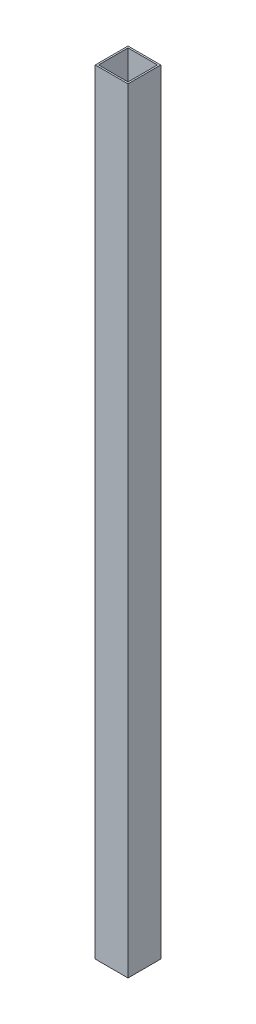
from build123d import *

# Parameters (mm, degrees)
SKETCH1_W           = 25.4
SKETCH1_H           = 25.4
SKETCH1_W_2         = 22.86
SKETCH1_H_2         = 22.86
BOSS_EXTRUDE1_DEPTH = 600


with BuildPart() as part:
    # Sketch1 → Boss-Extrude1 (new body)
    with BuildSketch(Plane(origin=(0, 0, 0), x_dir=(1, 0, 0), z_dir=(0, 1, 0))):
        with Locations((12.7, 12.7)):
            Rectangle(SKETCH1_W, SKETCH1_H)
        with Locations((12.7, 12.7)):
            Rectangle(SKETCH1_W_2, SKETCH1_H_2, mode=Mode.SUBTRACT)
    extrude(amount=BOSS_EXTRUDE1_DEPTH)


solid = part.part
